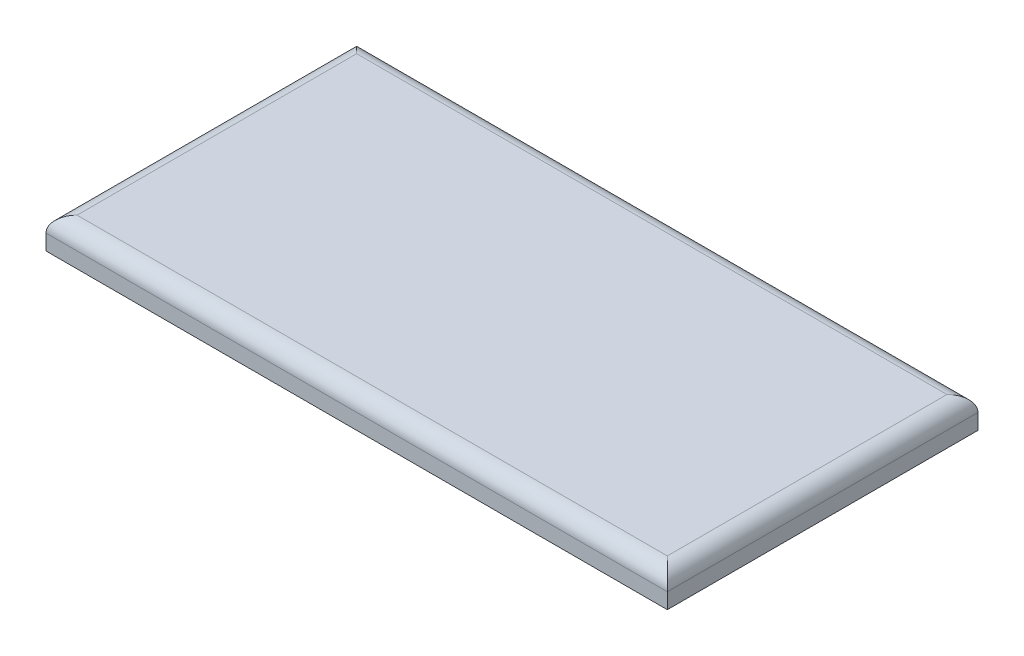
from build123d import *

# Parameters (mm, degrees)
SKETCH1_W           = 152.4
SKETCH1_H           = 76.2
BOSS_EXTRUDE1_DEPTH = 7.62
FILLET1_R           = 3.81


with BuildPart() as part:
    # Sketch1 → Boss-Extrude1 (new body)
    with BuildSketch(Plane(origin=(0, 0, 0), x_dir=(1, 0, 0), z_dir=(0, 1, 0))):
        with Locations((11.555143613, -20.956245985)):
            Rectangle(SKETCH1_W, SKETCH1_H)
    extrude(amount=BOSS_EXTRUDE1_DEPTH)

    # Fillet1
    fillet1_edges = [part.edges().sort_by_distance(p)[0] for p in [
        (87.755143613, 7.62, 20.956245985),
        (11.555143613, 7.62, -17.143754015),
        (-64.644856387, 7.62, 20.956245985),
        (11.555143613, 7.62, 59.056245985),
    ]]
    fillet(fillet1_edges, radius=FILLET1_R)


solid = part.part
